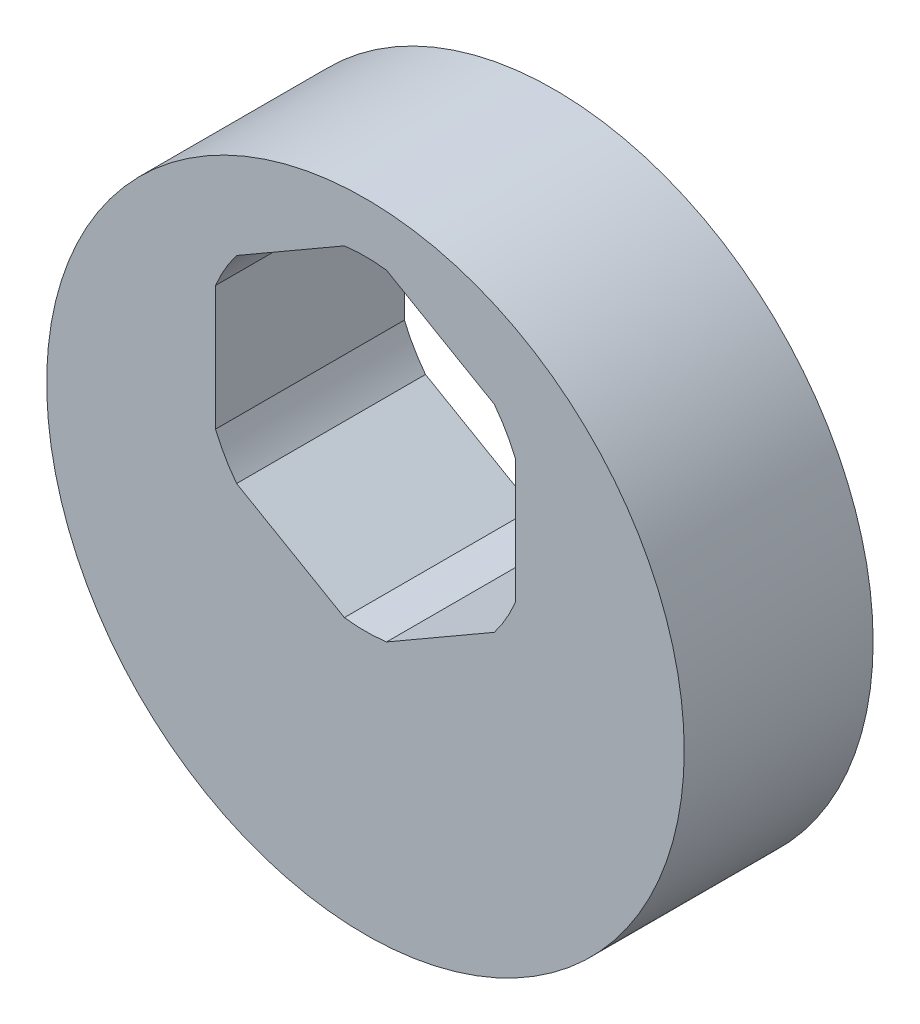
from build123d import *

# Parameters (mm, degrees)
SKETCH1_R           = 13.5
BOSS_EXTRUDE1_DEPTH = 4
CUT_EXTRUDE1_DEPTH  = 21.700241544


with BuildPart() as part:
    # Sketch1 → Boss-Extrude1 (new, symmetric)
    with BuildSketch(Plane.XY):
        Circle(SKETCH1_R)
    extrude(amount=BOSS_EXTRUDE1_DEPTH, both=True)

    # Sketch2 → Cut-Extrude1 (cut, through all)
    with BuildSketch(Plane.XY.offset(4)):
        with BuildLine():
            Line((-0.893039494, 11.316751826), (-5.456960506, 8.681770802))
            ThreePointArc((-5.456960506, 8.681770802), (-5.953924651, 7.9375), (-6.35, 7.134981025))
            Line((-6.35, 7.134981025), (-6.35, 1.865018975))
            ThreePointArc((-6.35, 1.865018975), (-5.953924651, 1.0625), (-5.456960506, 0.318229198))
            Line((-5.456960506, 0.318229198), (-0.893039494, -2.316751826))
            ThreePointArc((-0.893039494, -2.316751826), (0, -2.375), (0.893039494, -2.316751826))
            Line((0.893039494, -2.316751826), (5.456960506, 0.318229198))
            ThreePointArc((5.456960506, 0.318229198), (5.953924651, 1.0625), (6.35, 1.865018975))
            Line((6.35, 1.865018975), (6.35, 7.134981025))
            ThreePointArc((6.35, 7.134981025), (5.953924651, 7.9375), (5.456960506, 8.681770802))
            Line((5.456960506, 8.681770802), (0.893039494, 11.316751826))
            ThreePointArc((0.893039494, 11.316751826), (0, 11.375), (-0.893039494, 11.316751826))
        make_face()
    extrude(amount=-CUT_EXTRUDE1_DEPTH, mode=Mode.SUBTRACT)


solid = part.part
